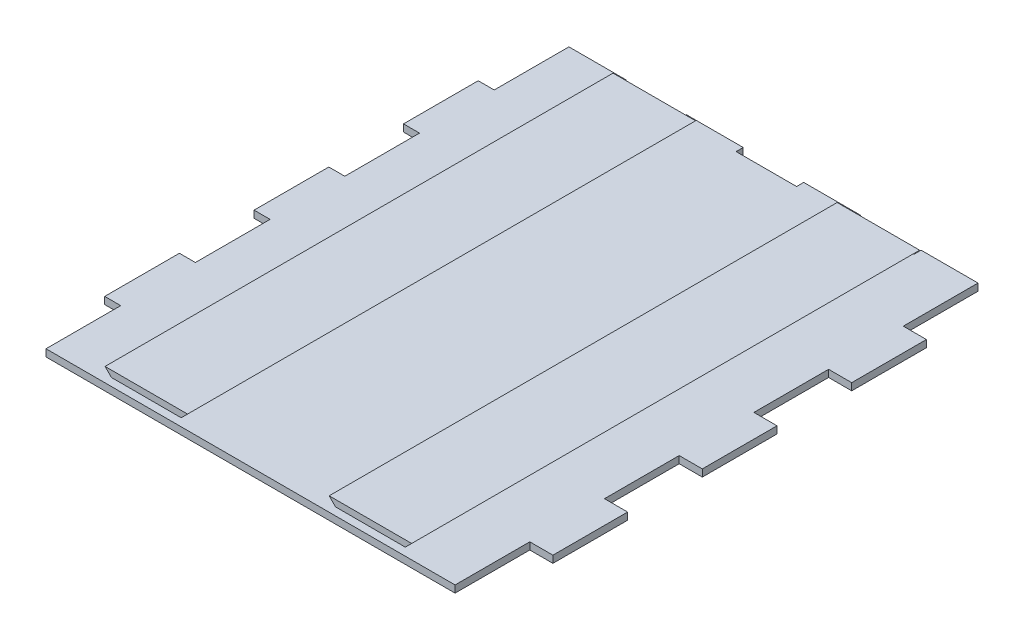
from build123d import *

# Parameters (mm, degrees)
SKETCH_4_W      = 115
SKETCH_4_H      = 145
EXTRUDE_1_DEPTH = 2
SKETCH_5_W      = 16
SKETCH_5_H      = 2
EXTRUDE_2_DEPTH = 2
SKETCH_6_W      = 21
SKETCH_6_H      = 2
EXTRUDE_3_DEPTH = 4.5
EXTRUDE_START   = -115
SKETCH_6_2_W    = 21
SKETCH_6_2_H    = 2
EXTRUDE_4_DEPTH = 6.5
EXTRUDE_START_2 = -2.2
EXTRUDE_5_DEPTH = 142.8


with BuildPart() as part:
    # 草图4 → 凸台-拉伸1 (new body)
    with BuildSketch(Plane(origin=(0, 0, 0), x_dir=(1, 0, 0), z_dir=(0, 1, 0))):
        Rectangle(SKETCH_4_W, SKETCH_4_H)
    extrude(amount=EXTRUDE_1_DEPTH)

    # 草图5 → 凸台-拉伸2 (add)
    with BuildSketch(Plane(origin=(0, 0, -72.5), x_dir=(-1, 0, 0), z_dir=(0, 0, -1))):
        with Locations((-49.5, 1)):
            Rectangle(SKETCH_5_W, SKETCH_5_H)
        with Locations((-16.5, 1)):
            Rectangle(SKETCH_5_W, SKETCH_5_H)
        with Locations((16.5, 1)):
            Rectangle(SKETCH_5_W, SKETCH_5_H)
        with Locations((49.5, 1)):
            Rectangle(SKETCH_5_W, SKETCH_5_H)
    extrude(amount=EXTRUDE_2_DEPTH)

    # 草图6 → 凸台-拉伸3 (add)
    with BuildSketch(Plane.ZY.offset(57.5)):
        with Locations((-43, 1)):
            Rectangle(SKETCH_6_W, SKETCH_6_H)
        with Locations((-1, 1)):
            Rectangle(SKETCH_6_W, SKETCH_6_H)
        with Locations((41, 1)):
            Rectangle(SKETCH_6_W, SKETCH_6_H)
    extrude(amount=EXTRUDE_3_DEPTH)

    # 草图6<2> → 凸台-拉伸4 (add)
    with BuildSketch(Plane.ZY.offset(57.5).offset(EXTRUDE_START)):
        with Locations((-43, 1)):
            Rectangle(SKETCH_6_2_W, SKETCH_6_2_H)
        with Locations((-1, 1)):
            Rectangle(SKETCH_6_2_W, SKETCH_6_2_H)
        with Locations((41, 1)):
            Rectangle(SKETCH_6_2_W, SKETCH_6_2_H)
    extrude(amount=-EXTRUDE_4_DEPTH)

    # 草图8 → 凸台-拉伸5 (add)
    with BuildSketch(Plane.XY.offset(72.5).offset(EXTRUDE_START_2)):
        Polygon((-43.1, 3.8), (-41.3, 2), (-21.7, 2), (-19.9, 3.8), (-21.7, 3.8), (-41.3, 3.8), align=None)
        Polygon((21.7, 2), (41.3, 2), (43.1, 3.8), (41.3, 3.8), (21.7, 3.8), (19.9, 3.8), align=None)
    extrude(amount=-EXTRUDE_5_DEPTH)


solid = part.part
